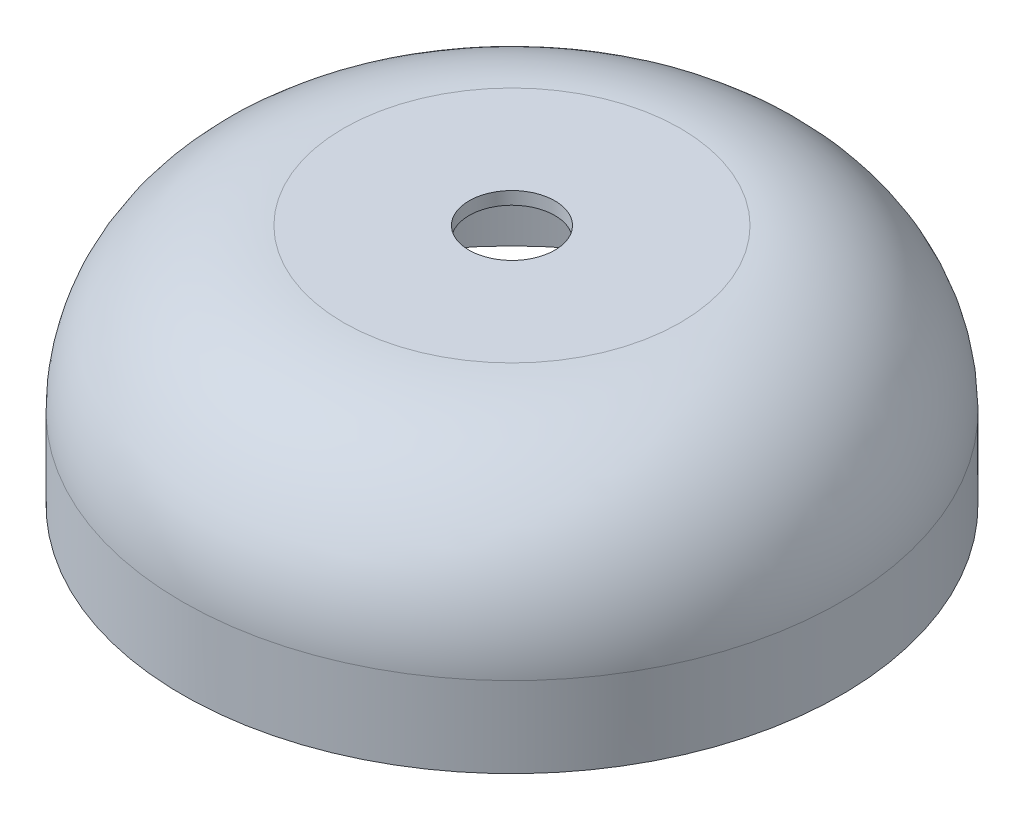
from build123d import *

# Parameters (mm, degrees)
SKETCH1_R           = 38.85
BOSS_EXTRUDE1_DEPTH = 28.5
FILLET1_R           = 19
SHELL1_T            = -1.5
SKETCH3_R           = 5.05
CUT_EXTRUDE1_DEPTH  = 62.894224286


with BuildPart() as part:
    # Sketch1 → Boss-Extrude1 (new body)
    with BuildSketch(Plane(origin=(0, 0, 0), x_dir=(1, 0, 0), z_dir=(0, 1, 0))):
        with Locations(Location((0, 0, 0), (0, 0, 90))):
            Circle(SKETCH1_R)
    extrude(amount=BOSS_EXTRUDE1_DEPTH)

    # Fillet1
    fillet1_edges = [part.edges().sort_by_distance(p)[0] for p in [
        (0, 28.5, 38.85),
    ]]
    fillet(fillet1_edges, radius=FILLET1_R)

    # Shell1
    shell1_openings = [part.faces().sort_by_distance(p)[0] for p in [
        (0, 0, 0),
    ]]
    offset(amount=SHELL1_T, openings=shell1_openings, kind=Kind.INTERSECTION)

    # Sketch3 → Cut-Extrude1 (cut, through all)
    with BuildSketch(Plane(origin=(0, 28.5, 0), x_dir=(1, 0, 0), z_dir=(0, 1, 0))):
        with Locations(Location((0, 0, 0), (0, 0, 270))):
            Circle(SKETCH3_R)
    extrude(amount=-CUT_EXTRUDE1_DEPTH, mode=Mode.SUBTRACT)


solid = part.part
